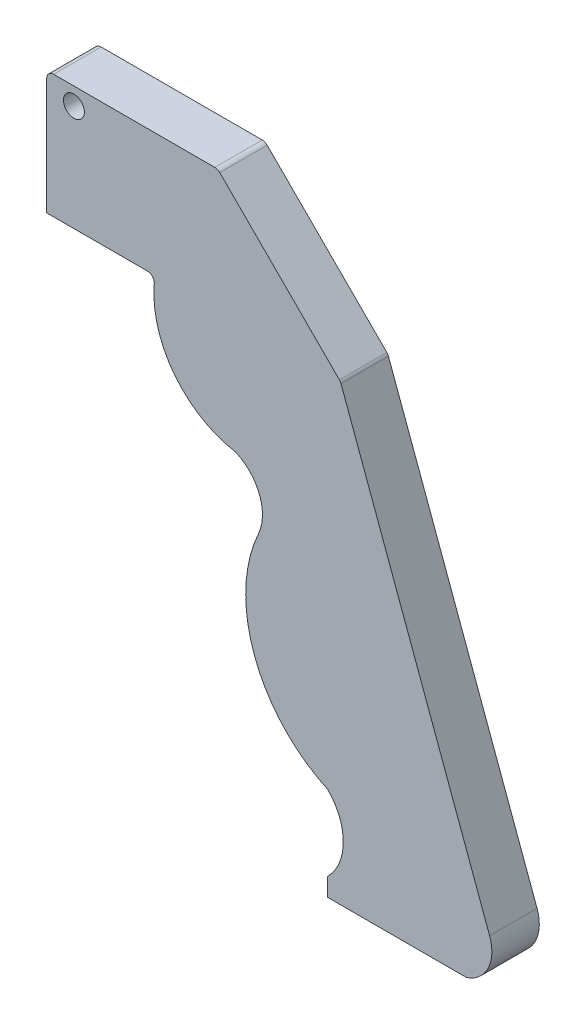
from build123d import *

# Parameters (mm, degrees)
SALIENTE_EXTRUIR1_DEPTH = 3.4
REDONDEO1_R             = 1
CROQUIS2_R              = 1.5
CORTAR_EXTRUIR1_DEPTH   = 92.234871739


with BuildPart() as part:
    # Croquis1 → Saliente-Extruir1 (new, symmetric)
    with BuildSketch(Plane.XY):
        with BuildLine():
            Line((0, 0), (0, 17.7))
            Line((0, 17.7), (24.52, 17.7))
            Line((24.52, 17.7), (42.112816716, 0.107183284))
            Line((42.112816716, 0.107183284), (63.497678713, -57.992177964))
            ThreePointArc((63.497678713, -57.992177964), (63.291104637, -62.125108825), (60.168100271, -64.84))
            Line((60.168100271, -64.84), (40.288100271, -64.84))
            Line((40.288100271, -64.84), (40.288100271, -62.22))
            ThreePointArc((40.288100271, -62.22), (42.521984385, -56.826926676), (40.288100271, -51.433853352))
            ThreePointArc((40.288100271, -51.433853352), (29.779800656, -40.049047756), (30.39958398, -24.5682846))
            ThreePointArc((30.39958398, -24.5682846), (30.487083192, -19.672969425), (27.087443921, -16.149587582))
            ThreePointArc((27.087443921, -16.149587582), (17.978818799, -10.462294263), (15.55957188, 0))
            Line((15.55957188, 0), (0, 0))
        make_face()
    extrude(amount=SALIENTE_EXTRUIR1_DEPTH, both=True)

    # Redondeo1
    redondeo1_edges = [part.edges().sort_by_distance(p)[0] for p in [
        (0, 17.7, 0),
        (24.52, 17.7, 0),
        (42.112816716, 0.107183284, 0),
        (15.55957188, 0, 0),
    ]]
    fillet(redondeo1_edges, radius=REDONDEO1_R)

    # Croquis2 → Cortar-Extruir1 (cut, through all)
    with BuildSketch(Plane.XY.offset(3.4)):
        with Locations((3.9, 15.2)):
            Circle(CROQUIS2_R)
    extrude(amount=-CORTAR_EXTRUIR1_DEPTH, mode=Mode.SUBTRACT)


solid = part.part
